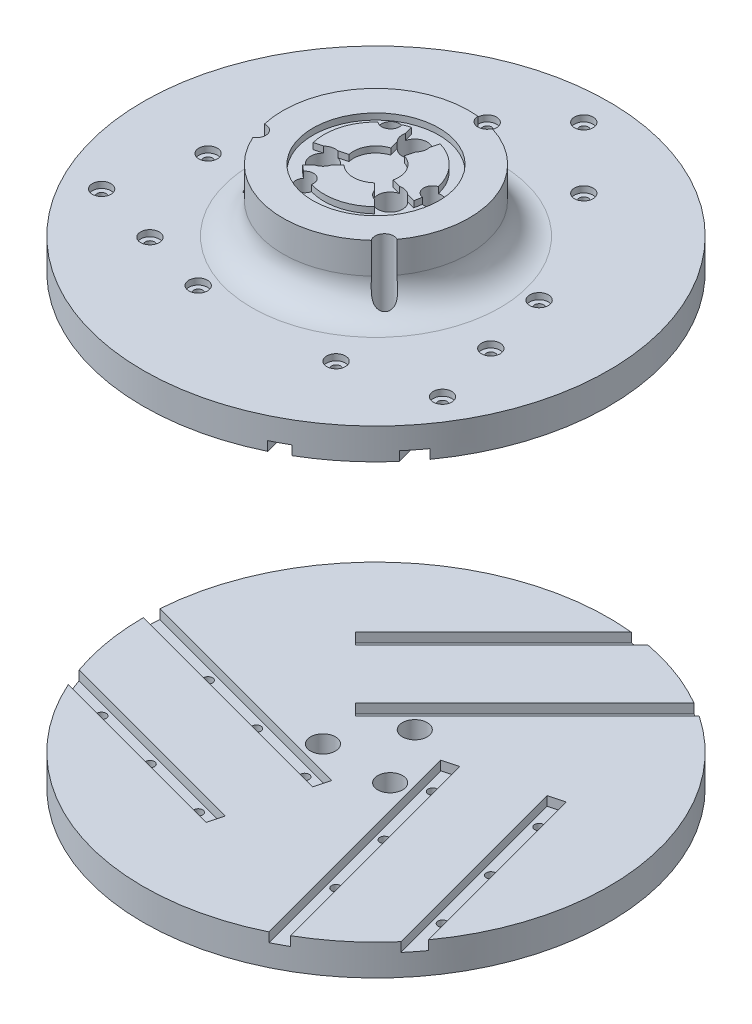
from build123d import *

# Parameters (mm, degrees)
SKETCH_1_R               = 75
EXTRUDE_1_DEPTH          = 10
SKETCH_2_R               = 75
EXTRUDE_2_DEPTH          = 10
SKETCH_3_R               = 30
EXTRUDE_3_DEPTH          = 20
CUT_EXTRUDE_1_DEPTH      = 204.779292373
CUT_EXTRUDE_1_DEPTH_BACK = 204.779292373
SKETCH_4_R               = 4
FILLET_1_R               = 10
SKETCH_7_R               = 1.45
CUT_EXTRUDE_5_DEPTH      = 3
CUT_EXTRUDE_START        = 3
SKETCH_9_R               = 1.45
CUT_EXTRUDE_6_DEPTH      = 3
SKETCH_7_2_R             = 1.45
CUT_EXTRUDE_7_DEPTH      = 196.310009984
SKETCH_13_R              = 3
CUT_EXTRUDE_8_DEPTH      = 2
SKETCH_9_2_R             = 1.45
CUT_EXTRUDE_9_DEPTH      = 179.846302729
CUT_EXTRUDE_START_2      = -2
SKETCH_14_R              = 2.869370649
SKETCH_14_R_2            = 3
CUT_EXTRUDE_10_DEPTH     = 2
SKETCH_14_2_R            = 3
SKETCH_14_2_R_2          = 2.869370649
SKETCH_14_2_R_3          = 1.45
CUT_EXTRUDE_11_DEPTH     = 187.991978438
SKETCH_16_R              = 20.3
CUT_EXTRUDE_12_DEPTH     = 2
CUT_EXTRUDE_14_DEPTH     = 3


with BuildPart() as part:
    # 草图1 → 凸台-拉伸1 (new body)
    with BuildSketch(Plane(origin=(0, 0, 0), x_dir=(1, 0, 0), z_dir=(0, 1, 0))):
        with Locations(Location((0, 0, 0), (0, 0, 270))):
            Circle(SKETCH_1_R)
    extrude(amount=EXTRUDE_1_DEPTH)


with BuildPart() as body_2:
    # 草图2 → 凸台-拉伸2 (new body)
    with BuildSketch(Plane(origin=(0, 144, 0), x_dir=(1, 0, 0), z_dir=(0, 1, 0))):
        with Locations(Location((0, 0, 0), (0, 0, 270))):
            Circle(SKETCH_2_R)
    extrude(amount=EXTRUDE_2_DEPTH)

    # 草图3 → 凸台-拉伸3 (add)
    with BuildSketch(Plane(origin=(0, 154, 0), x_dir=(1, 0, 0), z_dir=(0, 1, 0))):
        with Locations(Location((0, 0, 0), (0, 0, 270))):
            Circle(SKETCH_3_R)
    extrude(amount=EXTRUDE_3_DEPTH)


with BuildPart() as cut_extrude_1_tool:
    # 草图4 → 切除-拉伸1 (new, two sides: drawn at the far end of the back side and taken through both)
    with BuildSketch(Plane(origin=(0, 174, 0), x_dir=(1, 0, 0), z_dir=(0, 1, 0)).offset(-CUT_EXTRUDE_1_DEPTH_BACK)):
        with Locations(Location((0, 12.5, 0), (0, 0, 270))):
            Circle(SKETCH_4_R)
        with Locations(Location((-10.825317547, -6.25, 0), (0, 0, 270))):
            Circle(SKETCH_4_R)
        with Locations(Location((10.825317547, -6.25, 0), (0, 0, 270))):
            Circle(SKETCH_4_R)
    extrude(amount=CUT_EXTRUDE_1_DEPTH + CUT_EXTRUDE_1_DEPTH_BACK)


with BuildPart() as part_1:
    add(part.part)

    # 切除-拉伸1: cut by cut_extrude_1_tool
    add(cut_extrude_1_tool.part, mode=Mode.SUBTRACT)

    # 草图7 → 切除-拉伸5 (cut)
    # profile 1 of 6: a face of its own
    with BuildSketch(Plane(origin=(0, 10, 0), x_dir=(1, 0, 0), z_dir=(0, 1, 0))):
        Polygon((-3.889087297, 16.389087297), (-13.435028843, 6.843145751), (-16.970562748, 10.378679656), (39.597979746, 66.947222151), (43.133513652, 63.411688245), align=None)
        with Locations(Location((-9.545941546, 14.267766953, 0), (0, 0, 270))):
            Circle(SKETCH_7_R, mode=Mode.SUBTRACT)
        with Locations(Location((6.01040764, 29.824116139, 0), (0, 0, 270))):
            Circle(SKETCH_7_R, mode=Mode.SUBTRACT)
        with Locations(Location((21.566756826, 45.380465325, 0), (0, 0, 270))):
            Circle(SKETCH_7_R, mode=Mode.SUBTRACT)
    # profile 2 of 6: a face of its own
    with BuildSketch(Plane(origin=(0, 10, 0), x_dir=(1, 0, 0), z_dir=(0, 1, 0))):
        Polygon((-33.234018716, 26.642135624), (16.263455967, 76.139610307), (12.727922061, 79.675144213), (-36.769552622, 30.17766953), align=None)
        with Locations(Location((-29.344931419, 34.066756826, 0), (0, 0, 270))):
            Circle(SKETCH_7_R, mode=Mode.SUBTRACT)
        with Locations(Location((-13.788582233, 49.623106012, 0), (0, 0, 270))):
            Circle(SKETCH_7_R, mode=Mode.SUBTRACT)
        with Locations(Location((1.767766953, 65.179455198, 0), (0, 0, 270))):
            Circle(SKETCH_7_R, mode=Mode.SUBTRACT)
    # profile 3 of 6: a face of its own
    with BuildSketch(Plane(origin=(0, 10, 0), x_dir=(1, 0, 0), z_dir=(0, 1, 0))):
        Polygon((12.643852483, 8.213503403), (17.473481614, 9.507598628), (38.179005223, -67.766467475), (33.349376091, -69.0605627), (16.137909592, -4.826495252), align=None)
        with Locations(Location((28.517257394, -41.367591951, 0), (0, 0, 270))):
            Circle(SKETCH_7_R, mode=Mode.SUBTRACT)
        with Locations(Location((22.823238402, -20.117223773, 0), (0, 0, 270))):
            Circle(SKETCH_7_R, mode=Mode.SUBTRACT)
        with Locations(Location((17.12921941, 1.133144405, 0), (0, 0, 270))):
            Circle(SKETCH_7_R, mode=Mode.SUBTRACT)
    # profile 4 of 6: a face of its own
    with BuildSketch(Plane(origin=(0, 10, 0), x_dir=(1, 0, 0), z_dir=(0, 1, 0))):
        Polygon((62.636737908, -50.860275949), (44.519404751, 16.754531891), (39.689775619, 15.460436666), (57.807108776, -52.154371174), align=None)
        with Locations(Location((44.175142546, 8.380077668, 0), (0, 0, 270))):
            Circle(SKETCH_7_R, mode=Mode.SUBTRACT)
        with Locations(Location((49.869161538, -12.87029051, 0), (0, 0, 270))):
            Circle(SKETCH_7_R, mode=Mode.SUBTRACT)
        with Locations(Location((55.56318053, -34.120658688, 0), (0, 0, 270))):
            Circle(SKETCH_7_R, mode=Mode.SUBTRACT)
    # profile 5 of 6: a face of its own
    with BuildSketch(Plane(origin=(0, 10, 0), x_dir=(1, 0, 0), z_dir=(0, 1, 0))):
        Polygon((0.79117636, -15.056649153), (-0.502918866, -19.886278285), (-77.776984969, 0.819245323), (-76.482889744, 5.648874455), (-12.248822295, -11.562592045), align=None)
        with Locations(Location((-50.08401422, -4.012873374, 0), (0, 0, 270))):
            Circle(SKETCH_7_R, mode=Mode.SUBTRACT)
        with Locations(Location((-28.833646042, -9.706892366, 0), (0, 0, 270))):
            Circle(SKETCH_7_R, mode=Mode.SUBTRACT)
        with Locations(Location((-7.583277864, -15.400911358, 0), (0, 0, 270))):
            Circle(SKETCH_7_R, mode=Mode.SUBTRACT)
    # profile 6 of 6: a face of its own
    with BuildSketch(Plane(origin=(0, 10, 0), x_dir=(1, 0, 0), z_dir=(0, 1, 0))):
        Polygon((-75.364659969, -28.814868264), (-7.749852129, -46.932201421), (-6.455756903, -42.10257229), (-74.070564744, -23.985239132), align=None)
        with Locations(Location((-14.830211126, -42.446834494, 0), (0, 0, 270))):
            Circle(SKETCH_7_R, mode=Mode.SUBTRACT)
        with Locations(Location((-36.080579305, -36.752815502, 0), (0, 0, 270))):
            Circle(SKETCH_7_R, mode=Mode.SUBTRACT)
        with Locations(Location((-57.330947483, -31.05879651, 0), (0, 0, 270))):
            Circle(SKETCH_7_R, mode=Mode.SUBTRACT)
    extrude(amount=-CUT_EXTRUDE_5_DEPTH, mode=Mode.SUBTRACT)

    # 草图7<2> → 切除-拉伸7 (cut, through all)
    with BuildSketch(Plane(origin=(0, 10, 0), x_dir=(1, 0, 0), z_dir=(0, 1, 0))):
        with Locations(Location((6.01040764, 29.824116139, 0), (0, 0, 270))):
            Circle(SKETCH_7_2_R)
        with Locations(Location((21.566756826, 45.380465325, 0), (0, 0, 270))):
            Circle(SKETCH_7_2_R)
        with Locations(Location((-9.545941546, 14.267766953, 0), (0, 0, 270))):
            Circle(SKETCH_7_2_R)
        with Locations(Location((-29.344931419, 34.066756826, 0), (0, 0, 270))):
            Circle(SKETCH_7_2_R)
        with Locations(Location((-13.788582233, 49.623106012, 0), (0, 0, 270))):
            Circle(SKETCH_7_2_R)
        with Locations(Location((1.767766953, 65.179455198, 0), (0, 0, 270))):
            Circle(SKETCH_7_2_R)
        with Locations(Location((44.175142546, 8.380077668, 0), (0, 0, 270))):
            Circle(SKETCH_7_2_R)
        with Locations(Location((49.869161538, -12.87029051, 0), (0, 0, 270))):
            Circle(SKETCH_7_2_R)
        with Locations(Location((55.56318053, -34.120658688, 0), (0, 0, 270))):
            Circle(SKETCH_7_2_R)
        with Locations(Location((28.517257394, -41.367591951, 0), (0, 0, 270))):
            Circle(SKETCH_7_2_R)
        with Locations(Location((22.823238402, -20.117223773, 0), (0, 0, 270))):
            Circle(SKETCH_7_2_R)
        with Locations(Location((17.12921941, 1.133144405, 0), (0, 0, 270))):
            Circle(SKETCH_7_2_R)
        with Locations(Location((-7.583277864, -15.400911358, 0), (0, 0, 270))):
            Circle(SKETCH_7_2_R)
        with Locations(Location((-14.830211126, -42.446834494, 0), (0, 0, 270.000000001))):
            Circle(SKETCH_7_2_R)
        with Locations(Location((-36.080579305, -36.752815502, 0), (0, 0, 270.000000001))):
            Circle(SKETCH_7_2_R)
        with Locations(Location((-28.833646042, -9.706892366, 0), (0, 0, 270))):
            Circle(SKETCH_7_2_R)
        with Locations(Location((-57.330947483, -31.05879651, 0), (0, 0, 270.000000001))):
            Circle(SKETCH_7_2_R)
        with Locations(Location((-50.08401422, -4.012873374, 0), (0, 0, 270))):
            Circle(SKETCH_7_2_R)
    extrude(amount=-CUT_EXTRUDE_7_DEPTH, mode=Mode.SUBTRACT)

    # 草图13 → 切除-拉伸8 (cut)
    with BuildSketch(Plane.XZ):
        with Locations(Location((-14.830211126, 42.446834494, 0), (0, 0, 270))):
            Circle(SKETCH_13_R)
        with Locations(Location((-36.080579305, 36.752815502, 0), (0, 0, 270))):
            Circle(SKETCH_13_R)
        with Locations(Location((-57.330947483, 31.05879651, 0), (0, 0, 270))):
            Circle(SKETCH_13_R)
        with Locations(Location((-7.583277864, 15.400911358, 0), (0, 0, 270))):
            Circle(SKETCH_13_R)
        with Locations(Location((-28.833646042, 9.706892366, 0), (0, 0, 270))):
            Circle(SKETCH_13_R)
        with Locations(Location((-50.08401422, 4.012873374, 0), (0, 0, 270))):
            Circle(SKETCH_13_R)
        with Locations(Location((44.175142546, -8.380077668, 0), (0, 0, 270))):
            Circle(SKETCH_13_R)
        with Locations(Location((49.869161538, 12.87029051, 0), (0, 0, 270))):
            Circle(SKETCH_13_R)
        with Locations(Location((55.56318053, 34.120658688, 0), (0, 0, 270))):
            Circle(SKETCH_13_R)
        with Locations(Location((17.12921941, -1.133144405, 0), (0, 0, 270))):
            Circle(SKETCH_13_R)
        with Locations(Location((22.823238402, 20.117223773, 0), (0, 0, 270))):
            Circle(SKETCH_13_R)
        with Locations(Location((28.517257394, 41.367591951, 0), (0, 0, 270))):
            Circle(SKETCH_13_R)
        with Locations(Location((-29.344931419, -34.066756826, 0), (0, 0, 270))):
            Circle(SKETCH_13_R)
        with Locations(Location((-13.788582233, -49.623106012, 0), (0, 0, 270))):
            Circle(SKETCH_13_R)
        with Locations(Location((1.767766953, -65.179455198, 0), (0, 0, 270))):
            Circle(SKETCH_13_R)
        with Locations(Location((-9.545941546, -14.267766953, 0), (0, 0, 270))):
            Circle(SKETCH_13_R)
        with Locations(Location((6.01040764, -29.824116139, 0), (0, 0, 270))):
            Circle(SKETCH_13_R)
        with Locations(Location((21.566756826, -45.380465325, 0), (0, 0, 270))):
            Circle(SKETCH_13_R)
    extrude(amount=-CUT_EXTRUDE_8_DEPTH, mode=Mode.SUBTRACT)


with BuildPart() as body_2_1:
    add(body_2.part)

    # 切除-拉伸1: cut by cut_extrude_1_tool
    add(cut_extrude_1_tool.part, mode=Mode.SUBTRACT)

    # 圆角1
    fillet_1_edges = [body_2_1.edges().sort_by_distance(p)[0] for p in [
        (0, 154, -30),
    ]]
    fillet(fillet_1_edges, radius=FILLET_1_R)

    # 草图9 → 切除-拉伸6 (cut)
    # profile 1 of 6: a face of its own
    with BuildSketch(Plane(origin=(0, 144, 0), x_dir=(1, 0, 0), z_dir=(0, 1, 0)).offset(CUT_EXTRUDE_START)):
        Polygon((-3.889087297, 16.389087297), (-13.435028843, 6.843145751), (-16.970562748, 10.378679656), (39.597979746, 66.947222151), (43.133513652, 63.411688245), align=None)
        with Locations(Location((-9.545941546, 14.267766953, 0), (0, 0, 270))):
            Circle(SKETCH_9_R, mode=Mode.SUBTRACT)
        with Locations(Location((6.01040764, 29.824116139, 0), (0, 0, 270))):
            Circle(SKETCH_9_R, mode=Mode.SUBTRACT)
        with Locations(Location((21.566756826, 45.380465325, 0), (0, 0, 270))):
            Circle(SKETCH_9_R, mode=Mode.SUBTRACT)
    # profile 2 of 6: a face of its own
    with BuildSketch(Plane(origin=(0, 144, 0), x_dir=(1, 0, 0), z_dir=(0, 1, 0)).offset(CUT_EXTRUDE_START)):
        Polygon((-33.234018716, 26.642135624), (16.263455967, 76.139610307), (12.727922061, 79.675144213), (-36.769552622, 30.17766953), align=None)
        with Locations(Location((-29.344931419, 34.066756826, 0), (0, 0, 270))):
            Circle(SKETCH_9_R, mode=Mode.SUBTRACT)
        with Locations(Location((-13.788582233, 49.623106012, 0), (0, 0, 270))):
            Circle(SKETCH_9_R, mode=Mode.SUBTRACT)
        with Locations(Location((1.767766953, 65.179455198, 0), (0, 0, 270))):
            Circle(SKETCH_9_R, mode=Mode.SUBTRACT)
    # profile 3 of 6: a face of its own
    with BuildSketch(Plane(origin=(0, 144, 0), x_dir=(1, 0, 0), z_dir=(0, 1, 0)).offset(CUT_EXTRUDE_START)):
        Polygon((12.643852483, 8.213503403), (17.473481614, 9.507598628), (38.179005223, -67.766467475), (33.349376091, -69.0605627), (16.137909592, -4.826495252), align=None)
        with Locations(Location((28.517257394, -41.367591951, 0), (0, 0, 270))):
            Circle(SKETCH_9_R, mode=Mode.SUBTRACT)
        with Locations(Location((22.823238402, -20.117223773, 0), (0, 0, 270))):
            Circle(SKETCH_9_R, mode=Mode.SUBTRACT)
        with Locations(Location((17.12921941, 1.133144405, 0), (0, 0, 270))):
            Circle(SKETCH_9_R, mode=Mode.SUBTRACT)
    # profile 4 of 6: a face of its own
    with BuildSketch(Plane(origin=(0, 144, 0), x_dir=(1, 0, 0), z_dir=(0, 1, 0)).offset(CUT_EXTRUDE_START)):
        Polygon((62.636737908, -50.860275949), (44.519404751, 16.754531891), (39.689775619, 15.460436666), (57.807108776, -52.154371174), align=None)
        with Locations(Location((44.175142546, 8.380077668, 0), (0, 0, 270))):
            Circle(SKETCH_9_R, mode=Mode.SUBTRACT)
        with Locations(Location((49.869161538, -12.87029051, 0), (0, 0, 270))):
            Circle(SKETCH_9_R, mode=Mode.SUBTRACT)
        with Locations(Location((55.56318053, -34.120658688, 0), (0, 0, 270))):
            Circle(SKETCH_9_R, mode=Mode.SUBTRACT)
    # profile 5 of 6: a face of its own
    with BuildSketch(Plane(origin=(0, 144, 0), x_dir=(1, 0, 0), z_dir=(0, 1, 0)).offset(CUT_EXTRUDE_START)):
        Polygon((0.79117636, -15.056649153), (-0.502918866, -19.886278285), (-77.776984969, 0.819245323), (-76.482889744, 5.648874455), (-12.248822295, -11.562592045), align=None)
        with Locations(Location((-50.08401422, -4.012873374, 0), (0, 0, 270))):
            Circle(SKETCH_9_R, mode=Mode.SUBTRACT)
        with Locations(Location((-28.833646042, -9.706892366, 0), (0, 0, 270))):
            Circle(SKETCH_9_R, mode=Mode.SUBTRACT)
        with Locations(Location((-7.583277864, -15.400911358, 0), (0, 0, 270))):
            Circle(SKETCH_9_R, mode=Mode.SUBTRACT)
    # profile 6 of 6: a face of its own
    with BuildSketch(Plane(origin=(0, 144, 0), x_dir=(1, 0, 0), z_dir=(0, 1, 0)).offset(CUT_EXTRUDE_START)):
        Polygon((-75.364659969, -28.814868264), (-7.749852129, -46.932201421), (-6.455756903, -42.10257229), (-74.070564744, -23.985239132), align=None)
        with Locations(Location((-14.830211126, -42.446834494, 0), (0, 0, 270))):
            Circle(SKETCH_9_R, mode=Mode.SUBTRACT)
        with Locations(Location((-36.080579305, -36.752815502, 0), (0, 0, 270))):
            Circle(SKETCH_9_R, mode=Mode.SUBTRACT)
        with Locations(Location((-57.330947483, -31.05879651, 0), (0, 0, 270))):
            Circle(SKETCH_9_R, mode=Mode.SUBTRACT)
    extrude(amount=-CUT_EXTRUDE_6_DEPTH, mode=Mode.SUBTRACT)

    # 草图9<2> → 切除-拉伸9 (cut, through all)
    with BuildSketch(Plane(origin=(0, 144, 0), x_dir=(1, 0, 0), z_dir=(0, 1, 0))):
        with Locations(Location((1.767766953, 65.179455198, 0), (0, 0, 270))):
            Circle(SKETCH_9_2_R)
        with Locations(Location((-13.788582233, 49.623106012, 0), (0, 0, 270))):
            Circle(SKETCH_9_2_R)
        with Locations(Location((-29.344931419, 34.066756826, 0), (0, 0, 270))):
            Circle(SKETCH_9_2_R)
        with Locations(Location((21.566756826, 45.380465325, 0), (0, 0, 90))):
            Circle(SKETCH_9_2_R)
        with Locations(Location((6.01040764, 29.824116139, 0), (0, 0, 90))):
            Circle(SKETCH_9_2_R)
        with Locations(Location((-9.545941546, 14.267766953, 0), (0, 0, 90))):
            Circle(SKETCH_9_2_R)
        with Locations(Location((17.12921941, 1.133144405, 0), (0, 0, 90))):
            Circle(SKETCH_9_2_R)
        with Locations(Location((44.175142546, 8.380077668, 0), (0, 0, 270))):
            Circle(SKETCH_9_2_R)
        with Locations(Location((49.869161538, -12.87029051, 0), (0, 0, 270))):
            Circle(SKETCH_9_2_R)
        with Locations(Location((55.56318053, -34.120658688, 0), (0, 0, 270))):
            Circle(SKETCH_9_2_R)
        with Locations(Location((22.823238402, -20.117223773, 0), (0, 0, 90))):
            Circle(SKETCH_9_2_R)
        with Locations(Location((28.517257394, -41.367591951, 0), (0, 0, 90))):
            Circle(SKETCH_9_2_R)
        with Locations(Location((-14.830211126, -42.446834494, 0), (0, 0, 270))):
            Circle(SKETCH_9_2_R)
        with Locations(Location((-36.080579305, -36.752815502, 0), (0, 0, 270))):
            Circle(SKETCH_9_2_R)
        with Locations(Location((-57.330947483, -31.05879651, 0), (0, 0, 270))):
            Circle(SKETCH_9_2_R)
        with Locations(Location((-50.08401422, -4.012873374, 0), (0, 0, 90))):
            Circle(SKETCH_9_2_R)
        with Locations(Location((-28.833646042, -9.706892366, 0), (0, 0, 90))):
            Circle(SKETCH_9_2_R)
        with Locations(Location((-7.583277864, -15.400911358, 0), (0, 0, 90))):
            Circle(SKETCH_9_2_R)
    extrude(amount=CUT_EXTRUDE_9_DEPTH, mode=Mode.SUBTRACT)

    # 草图14 → 切除-拉伸10 (cut)
    with BuildSketch(Plane(origin=(0, 154, 0), x_dir=(1, 0, 0), z_dir=(0, 1, 0)).offset(CUT_EXTRUDE_START_2)):
        with Locations(Location((-9.545941546, 14.267766953, 0), (0, 0, 270))):
            Circle(SKETCH_14_R)
        with Locations(Location((6.01040764, 29.824116139, 0), (0, 0, 270))):
            Circle(SKETCH_14_R_2)
        with Locations(Location((21.566756826, 45.380465325, 0), (0, 0, 270))):
            Circle(SKETCH_14_R_2)
        with Locations(Location((-29.344931419, 34.066756826, 0), (0, 0, 270))):
            Circle(SKETCH_14_R_2)
        with Locations(Location((-13.788582233, 49.623106012, 0), (0, 0, 270))):
            Circle(SKETCH_14_R_2)
        with Locations(Location((1.767766953, 65.179455198, 0), (0, 0, 270))):
            Circle(SKETCH_14_R_2)
        with Locations(Location((17.12921941, 1.133144405, 0), (0, 0, 270))):
            Circle(SKETCH_14_R)
        with Locations(Location((22.823238402, -20.117223773, 0), (0, 0, 270))):
            Circle(SKETCH_14_R_2)
        with Locations(Location((28.517257394, -41.367591951, 0), (0, 0, 270))):
            Circle(SKETCH_14_R_2)
        with Locations(Location((44.175142546, 8.380077668, 0), (0, 0, 270))):
            Circle(SKETCH_14_R_2)
        with Locations(Location((49.869161538, -12.87029051, 0), (0, 0, 270))):
            Circle(SKETCH_14_R_2)
        with Locations(Location((55.56318053, -34.120658688, 0), (0, 0, 270))):
            Circle(SKETCH_14_R_2)
        with Locations(Location((-7.583277864, -15.400911358, 0), (0, 0, 270))):
            Circle(SKETCH_14_R)
        with Locations(Location((-28.833646042, -9.706892366, 0), (0, 0, 270))):
            Circle(SKETCH_14_R_2)
        with Locations(Location((-50.08401422, -4.012873374, 0), (0, 0, 270))):
            Circle(SKETCH_14_R_2)
        with Locations(Location((-14.830211126, -42.446834494, 0), (0, 0, 270))):
            Circle(SKETCH_14_R_2)
        with Locations(Location((-36.080579305, -36.752815502, 0), (0, 0, 270))):
            Circle(SKETCH_14_R_2)
        with Locations(Location((-57.330947483, -31.05879651, 0), (0, 0, 270))):
            Circle(SKETCH_14_R_2)
    extrude(amount=CUT_EXTRUDE_10_DEPTH, mode=Mode.SUBTRACT)

    # 草图14<2> → 切除-拉伸11 (cut, through all)
    # profile 1 of 6: a face of its own
    with BuildSketch(Plane(origin=(0, 154, 0), x_dir=(1, 0, 0), z_dir=(0, 1, 0))):
        with Locations(Location((6.01040764, 29.824116139, 0), (0, 0, 270))):
            Circle(SKETCH_14_2_R)
    # profile 2 of 6: a face of its own
    with BuildSketch(Plane(origin=(0, 154, 0), x_dir=(1, 0, 0), z_dir=(0, 1, 0))):
        with Locations(Location((-9.545941546, 14.267766953, 0), (0, 0, 270))):
            Circle(SKETCH_14_2_R_2)
        with Locations(Location((-9.545941546, 14.267766953, 0), (0, 0, 90))):
            Circle(SKETCH_14_2_R_3, mode=Mode.SUBTRACT)
    # profile 3 of 6: a face of its own
    with BuildSketch(Plane(origin=(0, 154, 0), x_dir=(1, 0, 0), z_dir=(0, 1, 0))):
        with Locations(Location((22.823238402, -20.117223773, 0), (0, 0, 270))):
            Circle(SKETCH_14_2_R)
    # profile 4 of 6: a face of its own
    with BuildSketch(Plane(origin=(0, 154, 0), x_dir=(1, 0, 0), z_dir=(0, 1, 0))):
        with Locations(Location((-7.583277864, -15.400911358, 0), (0, 0, 270))):
            Circle(SKETCH_14_2_R_2)
    # profile 5 of 6: a face of its own
    with BuildSketch(Plane(origin=(0, 154, 0), x_dir=(1, 0, 0), z_dir=(0, 1, 0))):
        with Locations(Location((-28.833646042, -9.706892366, 0), (0, 0, 270))):
            Circle(SKETCH_14_2_R)
    # profile 6 of 6: a face of its own
    with BuildSketch(Plane(origin=(0, 154, 0), x_dir=(1, 0, 0), z_dir=(0, 1, 0))):
        with Locations(Location((17.12921941, 1.133144405, 0), (0, 0, 270))):
            Circle(SKETCH_14_2_R_2)
    extrude(amount=CUT_EXTRUDE_11_DEPTH, mode=Mode.SUBTRACT)

    # 草图16 → 切除-拉伸12 (cut)
    with BuildSketch(Plane(origin=(0, 174, 0), x_dir=(1, 0, 0), z_dir=(0, 1, 0))):
        with Locations(Location((0, 0, 0), (0, 0, 270))):
            Circle(SKETCH_16_R)
        with BuildLine():
            Line((-7.122947392, -1.598005147), (-16.206004008, -4.031802832))
            ThreePointArc((-16.206004008, -4.031802832), (-14.462624243, 8.35), (-4.611358328, 16.050712581))
            Line((-4.611358328, 16.050712581), (-2.177560643, 6.967655965))
            ThreePointArc((-2.177560643, 6.967655965), (-6.321985448, 3.65), (-7.122947392, -1.598005147))
        make_face(mode=Mode.SUBTRACT)
        with BuildLine():
            Line((7.122947392, -1.598005147), (16.206004008, -4.031802832))
            ThreePointArc((16.206004008, -4.031802832), (14.462624243, 8.35), (4.611358328, 16.050712581))
            Line((4.611358328, 16.050712581), (2.177560643, 6.967655965))
            ThreePointArc((2.177560643, 6.967655965), (6.321985448, 3.65), (7.122947392, -1.598005147))
        make_face(mode=Mode.SUBTRACT)
        with BuildLine():
            Line((-4.945386749, -5.369650818), (-11.59464568, -12.018909749))
            ThreePointArc((-11.59464568, -12.018909749), (0, -16.7), (11.59464568, -12.018909749))
            Line((11.59464568, -12.018909749), (4.945386749, -5.369650818))
            ThreePointArc((4.945386749, -5.369650818), (0, -7.3), (-4.945386749, -5.369650818))
        make_face(mode=Mode.SUBTRACT)
    extrude(amount=-CUT_EXTRUDE_12_DEPTH, mode=Mode.SUBTRACT)

    # 草图18 → 切除-拉伸14 (cut)
    with BuildSketch(Plane.XZ.offset(-144)):
        Polygon((-7.537720094, 47.299624882), (-68.520116067, 30.959441129), (-72.416767611, 29.915336495), (-70.967380959, 24.506151867), (-6.088333442, 41.890440255), align=None)
        Polygon((-0.290786832, 20.253701746), (-75.077608069, 0.214633391), (-76.480818174, -0.161355623), (-75.031431521, -5.57054025), (1.158599821, 14.844517119), align=None)
        Polygon((44.731536785, -17.121955353), (61.071720538, 43.86044062), (62.115825173, 47.757092164), (56.706640546, 49.206478817), (39.322352158, -15.6725687), align=None)
        Polygon((17.685613649, -9.87502209), (37.724682004, 64.911799148), (38.100671018, 66.315009252), (32.691486391, 67.764395905), (12.276429022, -8.425635437), align=None)
        Polygon((-37.19381669, -30.17766953), (7.448395529, -74.819881749), (10.300942439, -77.672428659), (14.260740413, -73.712630684), (-33.234018716, -26.217871555), align=None)
        Polygon((-17.394826817, -10.378679656), (37.352926065, -65.126432539), (38.380147155, -66.153653629), (42.33994513, -62.193855654), (-13.435028843, -6.418881682), align=None)
    extrude(amount=-CUT_EXTRUDE_14_DEPTH, mode=Mode.SUBTRACT)


solid = Compound([part_1.part, body_2_1.part])
